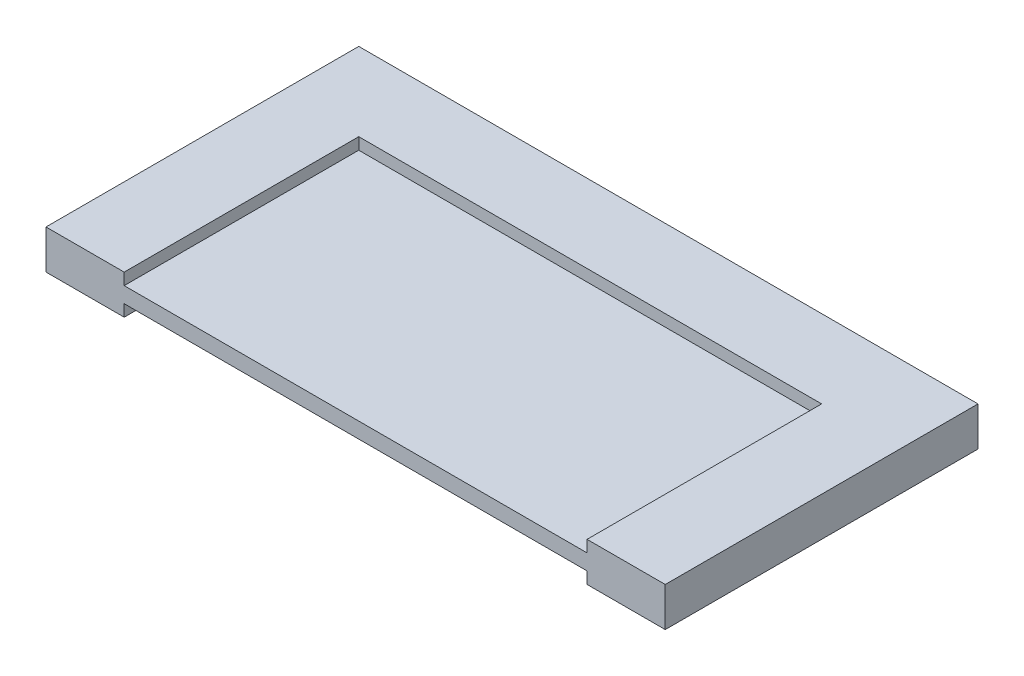
from build123d import *

# Parameters (mm, degrees)
BOSS_EXTRUDE1_DEPTH = 1.5875
SKETCH2_W           = 37.592
SKETCH2_H           = 19.05
BOSS_EXTRUDE2_DEPTH = 0.635


with BuildPart() as part:
    # Sketch1 → Boss-Extrude1 (new, symmetric)
    with BuildSketch(Plane(origin=(0, 0, 0), x_dir=(1, 0, 0), z_dir=(0, 1, 0))):
        Polygon((-25.146, 0), (-18.796, 0), (-18.796, 19.05), (18.796, 19.05), (18.796, 0), (25.146, 0), (25.146, 25.4), (-25.146, 25.4), align=None)
    extrude(amount=BOSS_EXTRUDE1_DEPTH, both=True)

    # Sketch2 → Boss-Extrude2 (add, symmetric)
    with BuildSketch(Plane(origin=(0, 0, 0), x_dir=(1, 0, 0), z_dir=(0, 1, 0))):
        with Locations((0, 9.525)):
            Rectangle(SKETCH2_W, SKETCH2_H)
    extrude(amount=BOSS_EXTRUDE2_DEPTH, both=True)


solid = part.part
